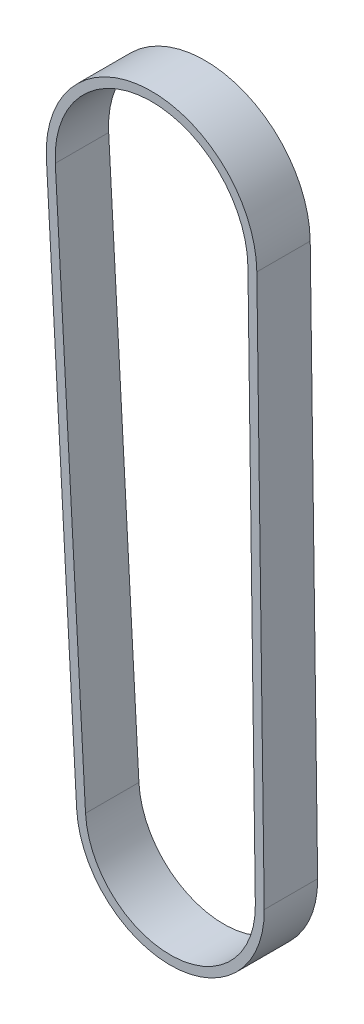
from build123d import *

# Parameters (mm, degrees)
EXTRUDE_THIN1_DEPTH = 9


with BuildPart() as part:
    # Sketch2 → Extrude-Thin1 (new body)
    with BuildSketch(Plane.XY):
        with BuildLine():
            Line((17.748380795, 0.239748095), (18.997501375, -92.231759343))
            ThreePointArc((18.997501375, -92.231759343), (3.718146226, -108.260112905), (-12.624882357, -93.317816281))
            Line((-12.624882357, -93.317816281), (-17.723008641, -0.978501261))
            ThreePointArc((-17.723008641, -0.978501261), (-0.609256768, 17.739540755), (17.748380795, 0.239748095))
        make_face()
        with BuildLine():
            Line((16.248517629, 0.219487692), (17.49763821, -92.252019745))
            ThreePointArc((17.49763821, -92.252019745), (3.666659739, -106.760996785), (-11.127163317, -93.235126033))
            Line((-11.127163317, -93.235126033), (-16.225289601, -0.895811013))
            ThreePointArc((-16.225289601, -0.895811013), (-0.557770281, 16.240424635), (16.248517629, 0.219487692))
        make_face(mode=Mode.SUBTRACT)
    extrude(amount=-EXTRUDE_THIN1_DEPTH)


solid = part.part
